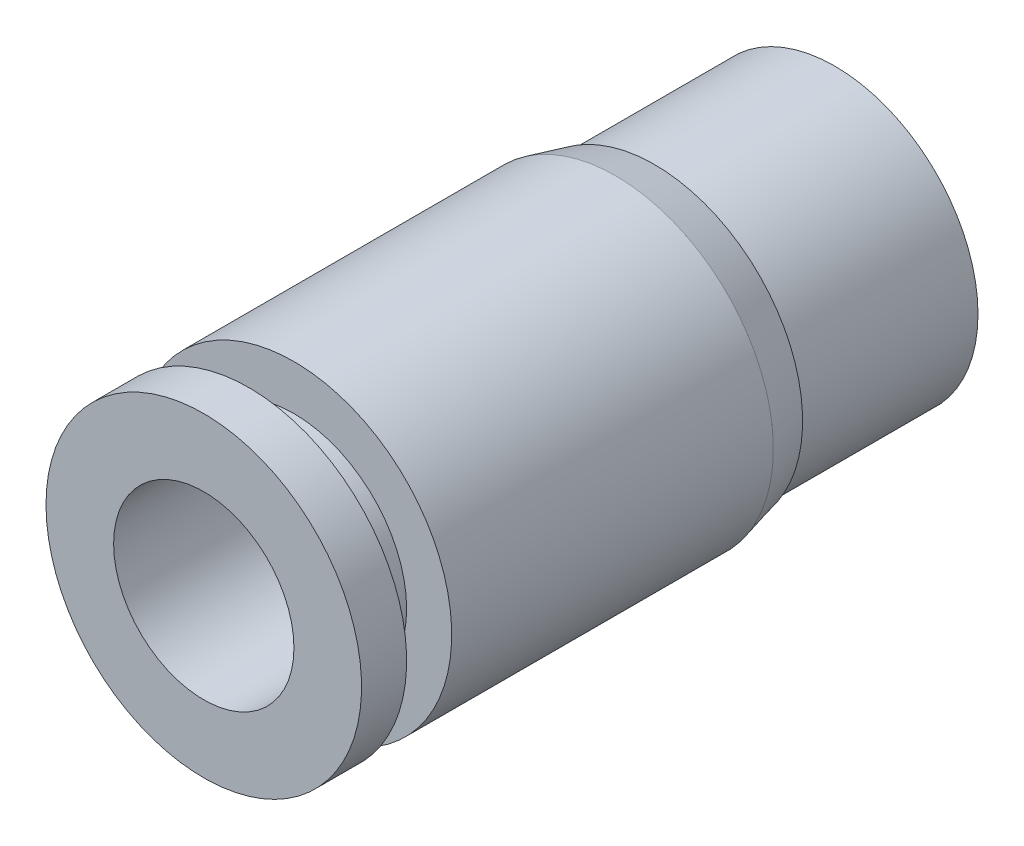
from build123d import *


with BuildPart() as part:
    # Sketch2 → Revolve1 (revolve)
    with BuildSketch(Plane(origin=(0, 0, 0), x_dir=(0, 0, -1), z_dir=(1, 0, 0)), mode=Mode.PRIVATE) as revolve1_sk:
        Polygon((-2, 2), (-10, 2), (-10, 3.5), (-9, 3.5), (-9, 2.5), (-8, 2.5), (-8, 3.5), (-0.86421887, 3.5), (0, 3.283945282), (0, 3.175), (4, 3.175), (4, 1.854706988), (-2, 1.854706988), align=None)
    revolve(revolve1_sk.sketch.rotate(Axis((0, 0, -4.7), (0, 0, 1)), 90), axis=Axis((0, 0, -4.7), (0, 0, 1)))


solid = part.part
